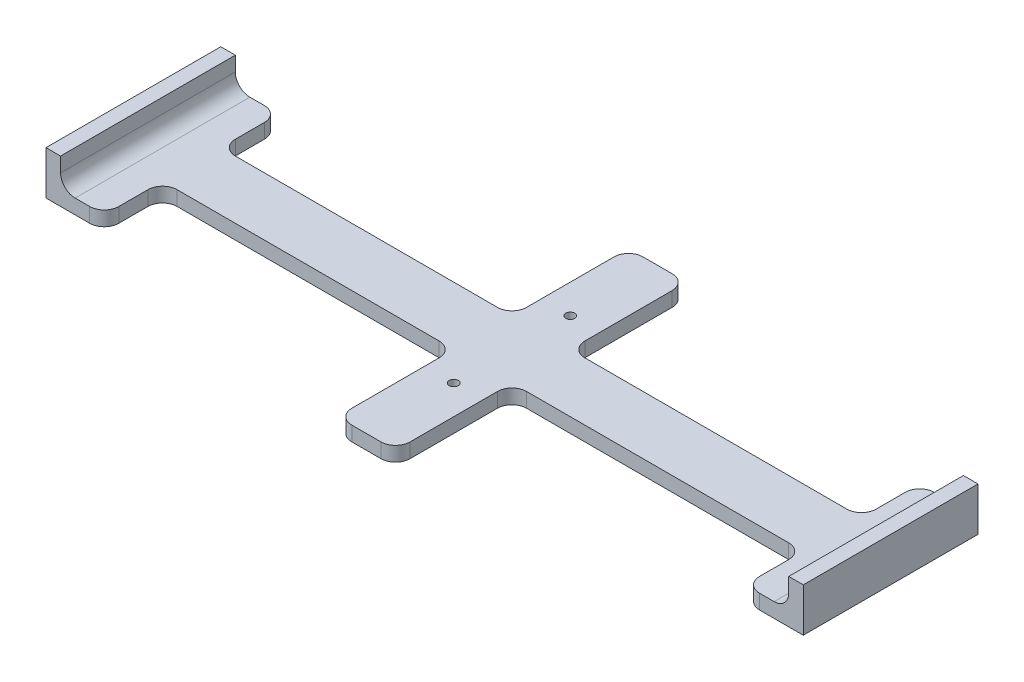
from build123d import *

# Parameters (mm, degrees)
SKETCH1_W                       = 127
SKETCH1_H                       = 25.4
SKETCH1_W_2                     = 25.4
SKETCH1_H_2                     = 50.8
BOSS_EXTRUDE1_DEPTH             = 3.175
F_5_32_0_15625_DIAMETER_HOLE1_D = 3.96875
SKETCH4_W                       = 6.35
SKETCH4_H                       = 76.2
BOSS_EXTRUDE2_DEPTH             = 12.7
FILLET2_R                       = 6.35


with BuildPart() as part:
    # Sketch1 → Boss-Extrude1 (new, symmetric)
    with BuildSketch(Plane(origin=(0, 0, 0), x_dir=(1, 0, 0), z_dir=(0, 1, 0))):
        Polygon((-139.7, -12.7), (-139.7, 12.7), (-139.7, 38.1), (-165.1, 38.1), (-165.1, -38.1), (-139.7, -38.1), align=None)
        with Locations((-76.2, 0)):
            Rectangle(SKETCH1_W, SKETCH1_H)
        with Locations((0, 38.1)):
            Rectangle(SKETCH1_W_2, SKETCH1_H_2)
        with Locations((76.2, 0)):
            Rectangle(SKETCH1_W, SKETCH1_H)
        Rectangle(SKETCH1_W_2, SKETCH1_H)
        with Locations((0, -38.1)):
            Rectangle(SKETCH1_W_2, SKETCH1_H_2)
        Polygon((139.7, 38.1), (139.7, 12.7), (139.7, -12.7), (139.7, -38.1), (165.1, -38.1), (165.1, 38.1), align=None)
    extrude(amount=BOSS_EXTRUDE1_DEPTH, both=True)

    # 5/32 (0.15625) Diameter Hole1 (through all)
    with Locations(Plane(origin=(0, 3.175, 0), x_dir=(1, 0, 0), z_dir=(0, 1, 0))):
        with Locations((0, 25.4), (0, -25.4)):
            Hole(F_5_32_0_15625_DIAMETER_HOLE1_D / 2)

    # Sketch4 → Boss-Extrude2 (add)
    with BuildSketch(Plane(origin=(0, 3.175, 0), x_dir=(1, 0, 0), z_dir=(0, 1, 0))):
        with Locations((161.925, 0)):
            Rectangle(SKETCH4_W, SKETCH4_H)
        with Locations((-161.925, 0)):
            Rectangle(SKETCH4_W, SKETCH4_H)
    extrude(amount=BOSS_EXTRUDE2_DEPTH)

    # Fillet2
    fillet2_edges = [part.edges().sort_by_distance(p)[0] for p in [
        (-139.7, 0, -12.7),
        (-12.7, 0, -12.7),
        (-12.7, 0, -63.5),
        (12.7, 0, -63.5),
        (12.7, 0, -12.7),
        (139.7, 0, -12.7),
        (139.7, 0, -38.1),
        (139.7, 0, 38.1),
        (139.7, 0, 12.7),
        (12.7, 0, 12.7),
        (12.7, 0, 63.5),
        (-12.7, 0, 63.5),
        (-12.7, 0, 12.7),
        (-139.7, 0, 12.7),
        (-139.7, 0, 38.1),
        (-139.7, 0, -38.1),
        (158.75, 3.175, 0),
        (-158.75, 3.175, 0),
    ]]
    fillet(fillet2_edges, radius=FILLET2_R)


solid = part.part
